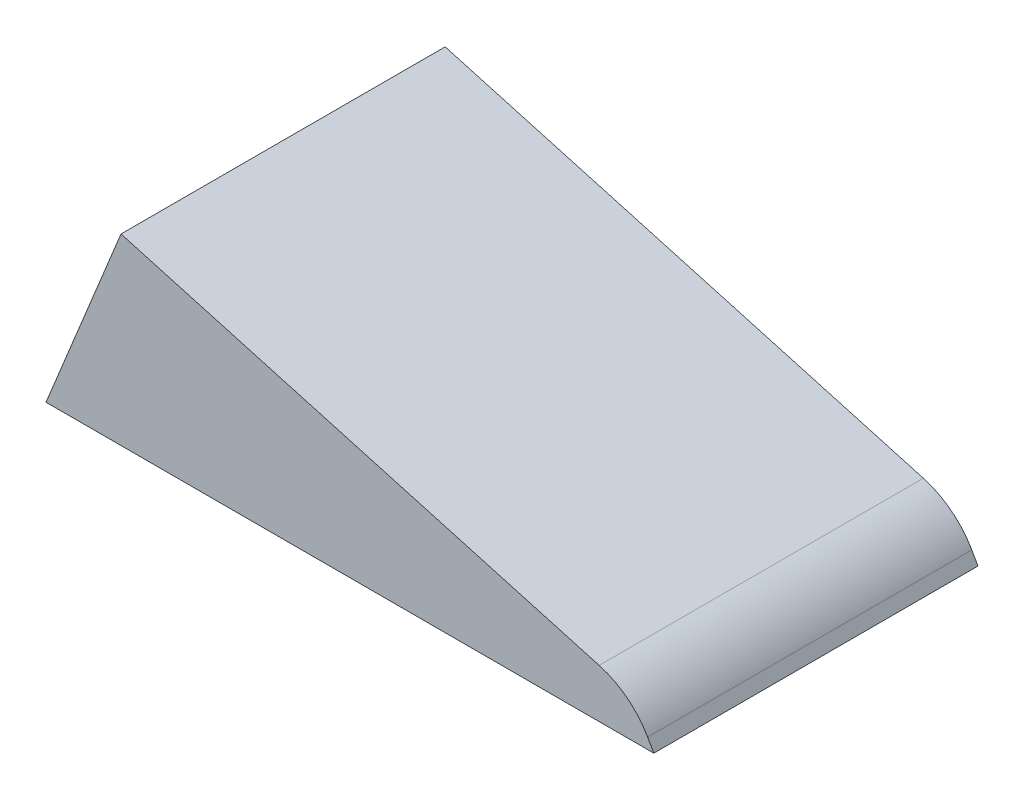
from build123d import *

# Parameters (mm, degrees)
BOSS_EXTRUDE1_DEPTH = 203.2
FILLET1_R           = 50.8


with BuildPart() as part:
    # Sketch1 → Boss-Extrude1 (new body)
    with BuildSketch(Plane.XY):
        Polygon((-87.817486522, -54.671821016), (-40.811660223, 60.180166362), (278.977822444, -29.772721235), (293.182513478, -54.671821016), align=None)
    extrude(amount=BOSS_EXTRUDE1_DEPTH)

    # Fillet1
    fillet1_edges = [part.edges().sort_by_distance(p)[0] for p in [
        (278.977822444, -29.772721235, 101.6),
    ]]
    fillet(fillet1_edges, radius=FILLET1_R)


solid = part.part
